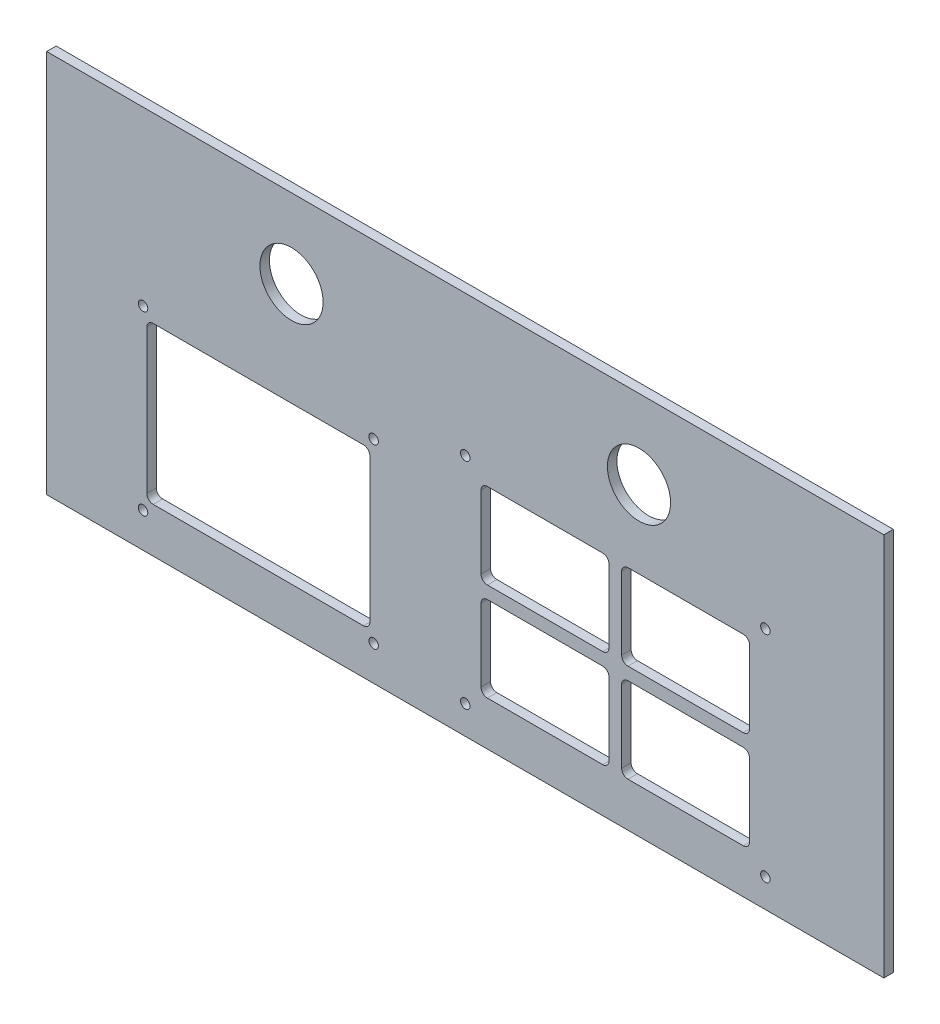
from build123d import *

# Parameters (mm, degrees)
SKETCH_1_W          = 265
SKETCH_1_H          = 121.5
EXTRUDE_1_DEPTH     = 3
SKETCH_2_R          = 10
CUT_EXTRUDE_1_DEPTH = 10
SKETCH_3_W          = 70.6
SKETCH_3_H          = 49.6
CUT_EXTRUDE_2_DEPTH = 3
FILLET_1_R          = 2
SKETCH_4_R          = 1.498589197
CUT_EXTRUDE_3_DEPTH = 10
SKETCH_5_R          = 1.5
CUT_EXTRUDE_4_DEPTH = 42
SKETCH_6_W          = 40.5
SKETCH_6_H          = 27
CUT_EXTRUDE_5_DEPTH = 22
FILLET_2_R          = 2


with BuildPart() as part:
    # 草图1 → 凸台-拉伸1 (new body)
    with BuildSketch(Plane.XY):
        Rectangle(SKETCH_1_W, SKETCH_1_H)
    extrude(amount=EXTRUDE_1_DEPTH)

    # 草图2 → 切除-拉伸1 (cut)
    with BuildSketch(Plane(origin=(0, 0, 0), x_dir=(-1, 0, 0), z_dir=(0, 0, -1))):
        with Locations((55, 35.75)):
            Circle(SKETCH_2_R)
    cut_extrude_1 = extrude(amount=-CUT_EXTRUDE_1_DEPTH, mode=Mode.SUBTRACT)

    # 镜向1: 切除-拉伸1 across plane
    add(cut_extrude_1.mirror(Plane(origin=(0, 0, 0), x_dir=(0, 0, 1), z_dir=(1, 0, 0))), mode=Mode.SUBTRACT)

    # 草图3 → 切除-拉伸2 (cut)
    with BuildSketch(Plane.XY.offset(3)):
        with Locations((-65.5, -21.75)):
            Rectangle(SKETCH_3_W, SKETCH_3_H)
    extrude(amount=-CUT_EXTRUDE_2_DEPTH, mode=Mode.SUBTRACT)

    # 圆角1
    fillet_1_edges = [part.edges().sort_by_distance(p)[0] for p in [
        (-100.8, 3.05, 1.5),
        (-100.8, -46.55, 1.5),
        (-30.2, -46.55, 1.5),
        (-30.2, 3.05, 1.5),
    ]]
    fillet(fillet_1_edges, radius=FILLET_1_R)

    # 草图4 → 切除-拉伸3 (cut)
    with BuildSketch(Plane.XY.offset(3)):
        with Locations((-29, -49.75)):
            Circle(SKETCH_4_R)
        with Locations((-29, 6.25)):
            Circle(SKETCH_4_R)
        with Locations((-102, -49.75)):
            Circle(SKETCH_4_R)
        with Locations((-102, 6.25)):
            Circle(SKETCH_4_R)
    extrude(amount=-CUT_EXTRUDE_3_DEPTH, mode=Mode.SUBTRACT)

    # 草图5 → 切除-拉伸4 (cut)
    with BuildSketch(Plane.XY.offset(3)):
        with Locations((95, 16.25)):
            Circle(SKETCH_5_R)
        with Locations((95, -51.75)):
            Circle(SKETCH_5_R)
        with Locations((0, -51.75)):
            Circle(SKETCH_5_R)
        with Locations((0, 16.25)):
            Circle(SKETCH_5_R)
    extrude(amount=-CUT_EXTRUDE_4_DEPTH, mode=Mode.SUBTRACT)

    # 草图6 → 切除-拉伸5 (cut)
    with BuildSketch(Plane.XY.offset(3)):
        with Locations((25.25, -33.25)):
            Rectangle(SKETCH_6_W, SKETCH_6_H)
        with Locations((25.25, -2.25)):
            Rectangle(SKETCH_6_W, SKETCH_6_H)
        with Locations((69.75, -2.25)):
            Rectangle(SKETCH_6_W, SKETCH_6_H)
        with Locations((69.75, -33.25)):
            Rectangle(SKETCH_6_W, SKETCH_6_H)
    extrude(amount=-CUT_EXTRUDE_5_DEPTH, mode=Mode.SUBTRACT)

    # 圆角2
    fillet_2_edges = [part.edges().sort_by_distance(p)[0] for p in [
        (49.5, -19.75, 1.5),
        (90, -19.75, 1.5),
        (90, -46.75, 1.5),
        (49.5, -46.75, 1.5),
        (49.5, 11.25, 1.5),
        (90, 11.25, 1.5),
        (90, -15.75, 1.5),
        (49.5, -15.75, 1.5),
        (5, -15.75, 1.5),
        (5, 11.25, 1.5),
        (45.5, 11.25, 1.5),
        (45.5, -15.75, 1.5),
        (45.5, -19.75, 1.5),
        (45.5, -46.75, 1.5),
        (5, -46.75, 1.5),
        (5, -19.75, 1.5),
    ]]
    fillet(fillet_2_edges, radius=FILLET_2_R)


solid = part.part
